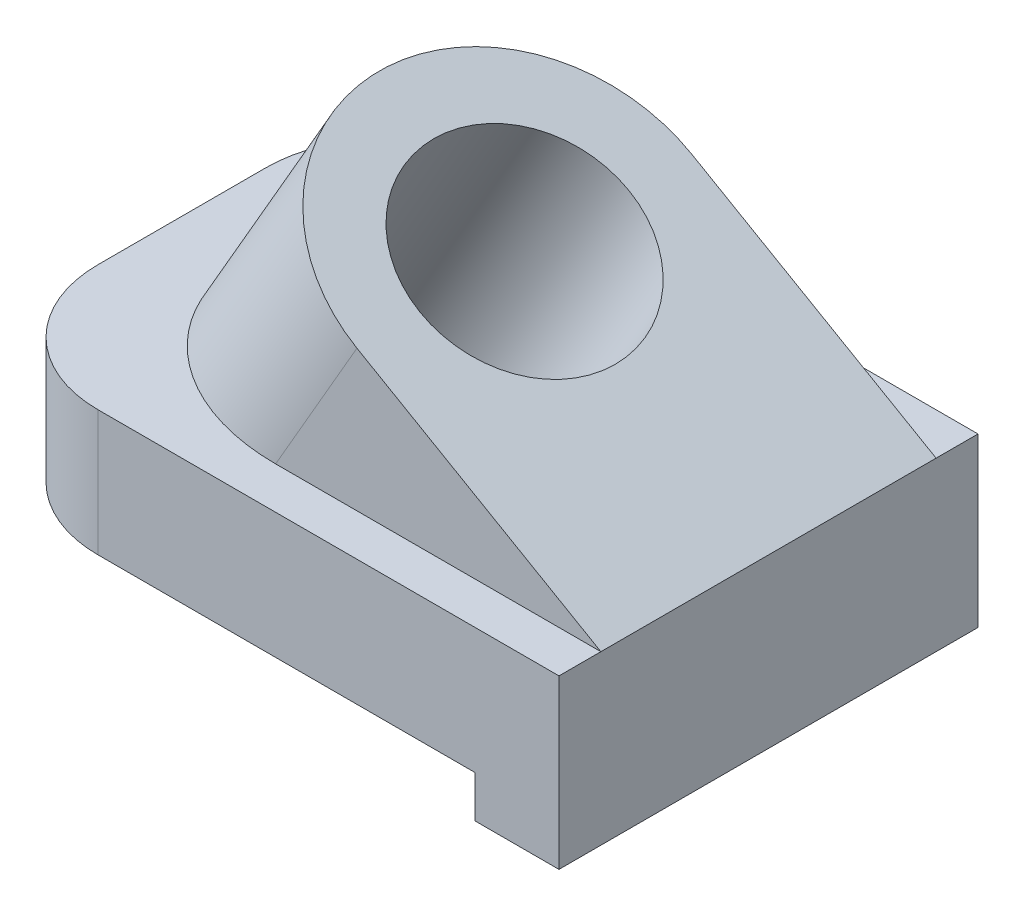
from build123d import *

# Parameters (mm, degrees)
BOSS_EXTRUDE1_DEPTH = 25
FILLET1_R           = 15
BOSS_EXTRUDE2_REACH = 69.823
SKETCH3_R           = 12.5
CUT_EXTRUDE1_DEPTH  = 68.823299831


with BuildPart() as part:
    # Sketch1 → Boss-Extrude1 (new, symmetric)
    with BuildSketch(Plane.XY):
        Polygon((60, 0), (70, 0), (70, 20), (0, 20), (0, 5), (60, 5), align=None)
    extrude(amount=BOSS_EXTRUDE1_DEPTH, both=True)

    # Fillet1
    fillet1_edges = [part.edges().sort_by_distance(p)[0] for p in [
        (0, 12.5, 25),
        (0, 12.5, -25),
    ]]
    fillet(fillet1_edges, radius=FILLET1_R)

    # Boss-Extrude2: up to this face of the body (flat: up to its plane)
    boss_extrude2_end = Plane(part.part.faces().sort_by_distance((35.898040292, 20, 0))[0])
    # Sketch2 → Boss-Extrude2 (add, up to the picked face)
    with BuildSketch(Plane(origin=(26.160254038, 45.310889132, 0), x_dir=(0, 0, -1), z_dir=(0.500000000000001, 0.866025403784438, 0)), mode=Mode.PRIVATE) as boss_extrude2_sk1:
        with BuildLine():
            Line((-20, -50.621778265), (20, -50.621778265))
            Line((20, -50.621778265), (20, -17.011053667))
            ThreePointArc((20, -17.011053667), (0, 2.988946333), (-20, -17.011053667))
            Line((-20, -17.011053667), (-20, -50.621778265))
        make_face()
    boss_extrude2_tool1 = split(extrude(boss_extrude2_sk1.sketch, amount=-BOSS_EXTRUDE2_REACH, mode=Mode.PRIVATE), bisect_by=boss_extrude2_end, keep=Keep.BOTH, mode=Mode.PRIVATE)
    add(boss_extrude2_tool1.solids().sort_by(Axis((48.469429, 32.430681, 0), (-0.500000000000001, -0.866025403784438, 0)))[0])

    # Sketch3 → Cut-Extrude1 (cut, through all)
    with BuildSketch(Plane(origin=(26.160254038, 45.310889132, 0), x_dir=(0, 0, -1), z_dir=(0.500000000000001, 0.866025403784438, 0))):
        with Locations(Location((0, -17.011053667, 0), (0, 0, 90))):
            Circle(SKETCH3_R)
    extrude(amount=-CUT_EXTRUDE1_DEPTH, mode=Mode.SUBTRACT)


solid = part.part
